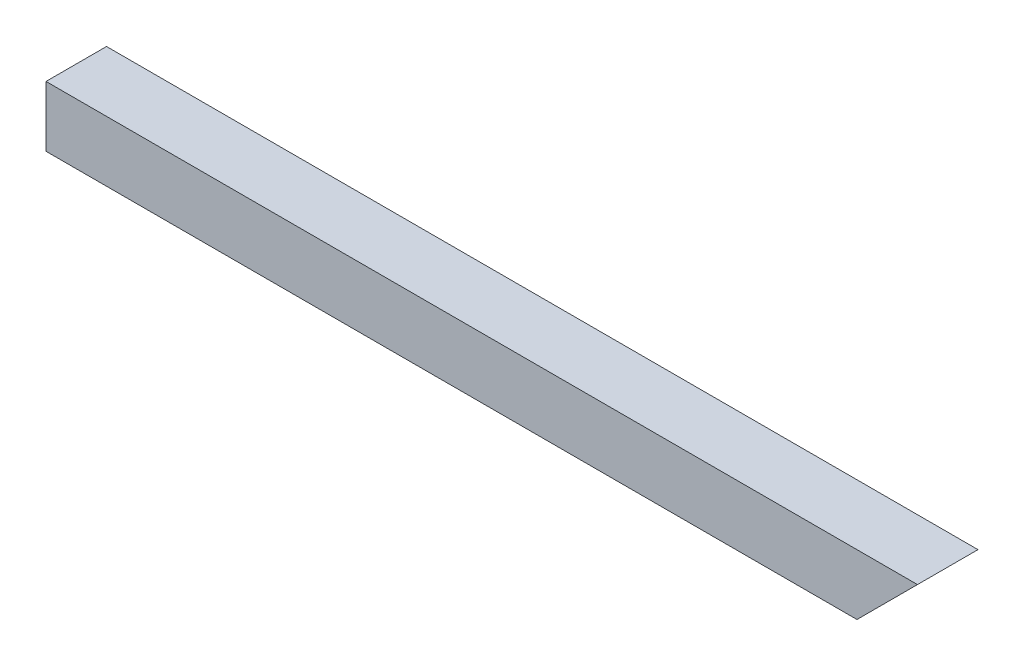
from build123d import *

# Parameters (mm, degrees)
SKETCH1_W           = 25
SKETCH1_H           = 25
SKETCH1_W_2         = 23
SKETCH1_H_2         = 23
BOSS_EXTRUDE1_DEPTH = 360
CUT_EXTRUDE3_DEPTH  = 360


with BuildPart() as part:
    # Sketch1 → Boss-Extrude1 (new body)
    with BuildSketch(Plane(origin=(0, 0, 0), x_dir=(0, 0, -1), z_dir=(1, 0, 0))):
        Rectangle(SKETCH1_W, SKETCH1_H)
        Rectangle(SKETCH1_W_2, SKETCH1_H_2, mode=Mode.SUBTRACT)
    extrude(amount=BOSS_EXTRUDE1_DEPTH)

    # Sketch2 → Cut-Extrude3 (cut)
    with BuildSketch(Plane.XY.offset(12.5)):
        Polygon((360, 12.5), (335, -12.5), (360, -12.5), align=None)
    extrude(amount=-CUT_EXTRUDE3_DEPTH, mode=Mode.SUBTRACT)


solid = part.part
